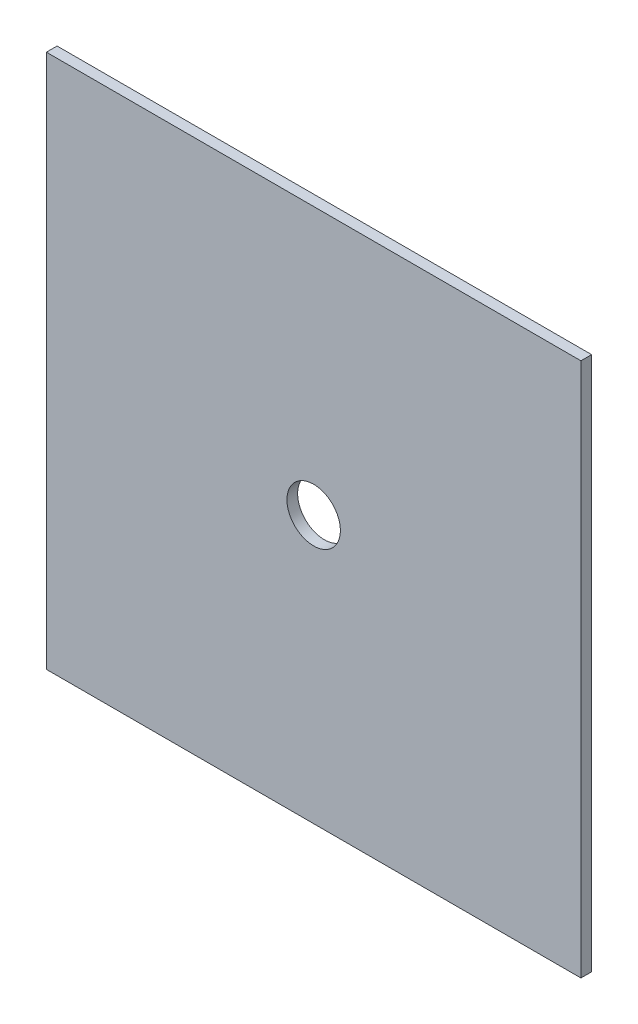
from build123d import *

# Parameters (mm, degrees)
SKETCH_1_W          = 100
SKETCH_1_H          = 100
EXTRUDE_1_DEPTH     = 2
SKETCH_2_R          = 5
CUT_EXTRUDE_1_DEPTH = 71.738956735


with BuildPart() as part:
    # 草圖1 → 填料-伸長1 (new body)
    with BuildSketch(Plane.XY):
        Rectangle(SKETCH_1_W, SKETCH_1_H)
    extrude(amount=EXTRUDE_1_DEPTH)

    # 草圖2 → 除料-伸長1 (cut, through all)
    with BuildSketch(Plane.XY.offset(2)):
        Circle(SKETCH_2_R)
    extrude(amount=-CUT_EXTRUDE_1_DEPTH, mode=Mode.SUBTRACT)


solid = part.part
